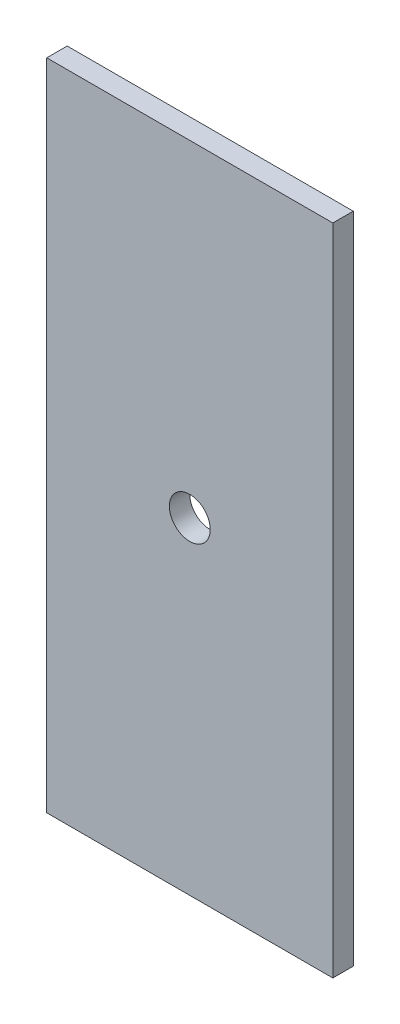
from build123d import *

# Parameters (mm, degrees)
SKETCH1_W                  = 88.9
SKETCH1_H                  = 203.2
BOSS_EXTRUDE1_DEPTH        = 3.175
F_1_2_0_5_DIAMETER_HOLE1_D = 12.7


with BuildPart() as part:
    # Sketch1 → Boss-Extrude1 (new, symmetric)
    with BuildSketch(Plane.XY):
        Rectangle(SKETCH1_W, SKETCH1_H)
    extrude(amount=BOSS_EXTRUDE1_DEPTH, both=True)

    # 1/2 (0.5) Diameter Hole1 (through all)
    with Locations(Plane.XY.offset(3.175)):
        with Locations((0, 0)):
            Hole(F_1_2_0_5_DIAMETER_HOLE1_D / 2)


solid = part.part
